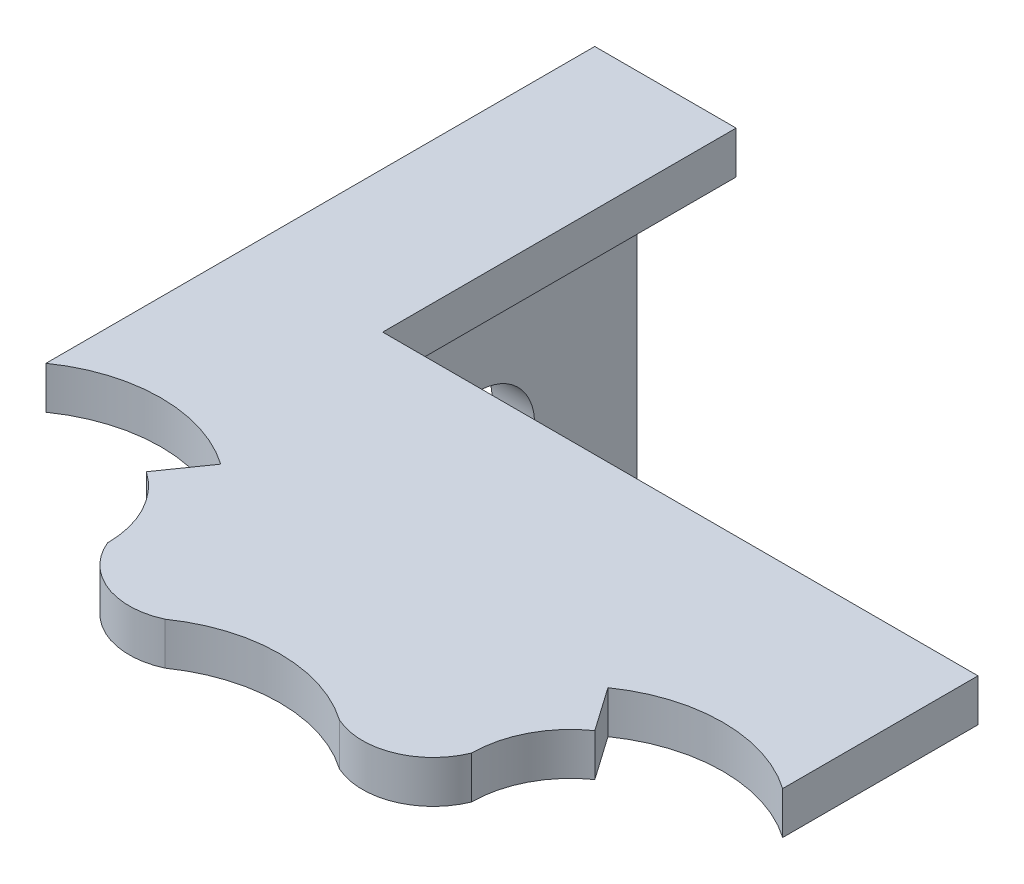
from build123d import *

# Parameters (mm, degrees)
BOSS_EXTRUDE1_DEPTH = 3
SKETCH3_W           = 3
SKETCH3_H           = 22.5
BOSS_EXTRUDE2_DEPTH = 25
SKETCH4_R           = 4
CUT_EXTRUDE1_DEPTH  = 3


with BuildPart() as part:
    # Sketch2 → Boss-Extrude1 (new body)
    with BuildSketch(Plane(origin=(0, 0, 0), x_dir=(1, 0, 0), z_dir=(0, 1, 0))):
        with BuildLine():
            Line((-15.860247962, 17.20906431), (-13.694996915, 20.301363277))
            ThreePointArc((-13.694996915, 20.301363277), (-19.875283017, 22.25), (-26.055569119, 20.301363277))
            Line((-26.055569119, 20.301363277), (-26.055569119, 34.118363277))
            Line((-26.055569119, 34.118363277), (-26.055569119, 59.118363277))
            Line((-26.055569119, 59.118363277), (-16.055569119, 59.118363277))
            Line((-16.055569119, 59.118363277), (-16.055569119, 34.118363277))
            Line((-16.055569119, 34.118363277), (26.055569119, 34.118363277))
            Line((26.055569119, 34.118363277), (26.055569119, 20.301363277))
            ThreePointArc((26.055569119, 20.301363277), (19.875283017, 22.25), (13.694996915, 20.301363277))
            Line((13.694996915, 20.301363277), (15.860247962, 17.20906431))
            ThreePointArc((15.860247962, 17.20906431), (13.666207185, 14.707240293), (12.875283017, 11.475))
            ThreePointArc((12.875283017, 11.475), (10.090653959, 8.727908609), (6.180286102, 8.826363277))
            ThreePointArc((6.180286102, 8.826363277), (0, 10.775), (-6.180286102, 8.826363277))
            ThreePointArc((-6.180286102, 8.826363277), (-10.090653959, 8.727908609), (-12.875283017, 11.475))
            ThreePointArc((-12.875283017, 11.475), (-13.666207185, 14.707240293), (-15.860247962, 17.20906431))
        make_face()
    extrude(amount=BOSS_EXTRUDE1_DEPTH)

    # Sketch3 → Boss-Extrude2 (add)
    with BuildSketch(Plane.XZ):
        with Locations((-24.555569119, -47.868363277)):
            Rectangle(SKETCH3_W, SKETCH3_H)
    extrude(amount=BOSS_EXTRUDE2_DEPTH)

    # Sketch4 → Cut-Extrude1 (cut)
    with BuildSketch(Plane.ZY.offset(26.055569119)):
        with Locations((-47.868363277, -15)):
            Circle(SKETCH4_R)
    extrude(amount=-CUT_EXTRUDE1_DEPTH, mode=Mode.SUBTRACT)


solid = part.part
